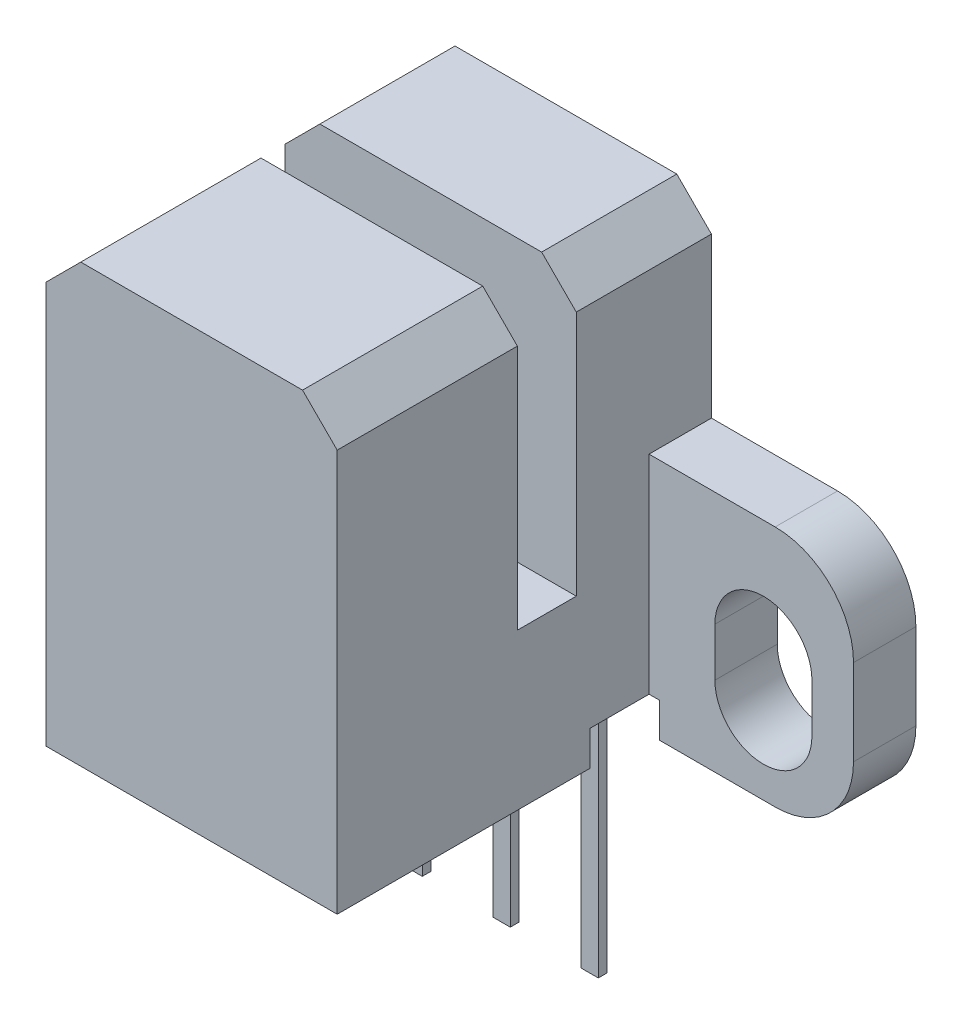
from build123d import *

# Parameters (mm, degrees)
SKETCH1_W           = 8.4
SKETCH1_H           = 12.6
BOSS_EXTRUDE1_DEPTH = 10.8
CHAMFER1_SIZE       = 1
BOSS_EXTRUDE2_DEPTH = 1.8
SKETCH3_W           = 8.4
SKETCH3_H           = 1.7
CUT_EXTRUDE1_DEPTH  = 8.1
SKETCH4_R           = 1
BOSS_EXTRUDE3_DEPTH = 0.8
SKETCH5_W           = 9
SKETCH5_H           = 3.5
CUT_EXTRUDE2_DEPTH  = 1
SKETCH6_W           = 0.5
SKETCH6_H           = 6.5
BOSS_EXTRUDE4_DEPTH = 0.125


with BuildPart() as part:
    # Sketch1 → Boss-Extrude1 (new body)
    with BuildSketch(Plane.XY):
        with Locations((0, -2.4)):
            Rectangle(SKETCH1_W, SKETCH1_H)
    extrude(amount=BOSS_EXTRUDE1_DEPTH)

    # Chamfer1
    chamfer1_edges = [part.edges().sort_by_distance(p)[0] for p in [
        (-4.2, 3.9, 5.4),
        (4.2, 3.9, 5.4),
    ]]
    chamfer(chamfer1_edges, length=CHAMFER1_SIZE)

    # Sketch2 → Boss-Extrude2 (add)
    with BuildSketch(Plane(origin=(0, 0, 0), x_dir=(-1, 0, 0), z_dir=(0, 0, -1))):
        with BuildLine():
            Line((-7.84, -8.7), (7.84, -8.7))
            ThreePointArc((7.84, -8.7), (9.438061325, -8.038061325), (10.1, -6.44))
            Line((10.1, -6.44), (10.1, -3.96))
            ThreePointArc((10.1, -3.96), (9.438061325, -2.361938675), (7.84, -1.7))
            Line((7.84, -1.7), (-7.84, -1.7))
            ThreePointArc((-7.84, -1.7), (-9.438061325, -2.361938675), (-10.1, -3.96))
            Line((-10.1, -3.96), (-10.1, -6.44))
            ThreePointArc((-10.1, -6.44), (-9.438061325, -8.038061325), (-7.84, -8.7))
        make_face()
        with BuildLine():
            Line((-6.1, -5), (-6.1, -6.4))
            ThreePointArc((-6.1, -6.4), (-7.5, -7.8), (-8.9, -6.4))
            Line((-8.9, -6.4), (-8.9, -5))
            ThreePointArc((-8.9, -5), (-7.5, -3.6), (-6.1, -5))
        make_face(mode=Mode.SUBTRACT)
        with BuildLine():
            Line((8.9, -5), (8.9, -6.4))
            ThreePointArc((8.9, -6.4), (7.5, -7.8), (6.1, -6.4))
            Line((6.1, -6.4), (6.1, -5))
            ThreePointArc((6.1, -5), (7.5, -3.6), (8.9, -5))
        make_face(mode=Mode.SUBTRACT)
    extrude(amount=-BOSS_EXTRUDE2_DEPTH)

    # Sketch3 → Cut-Extrude1 (cut)
    with BuildSketch(Plane(origin=(0, 3.9, 0), x_dir=(1, 0, 0), z_dir=(0, 1, 0))):
        with Locations((0, -4.75)):
            Rectangle(SKETCH3_W, SKETCH3_H)
    extrude(amount=-CUT_EXTRUDE1_DEPTH, mode=Mode.SUBTRACT)

    # Sketch4 → Boss-Extrude3 (add)
    with BuildSketch(Plane(origin=(0, 0, 0), x_dir=(-1, 0, 0), z_dir=(0, 0, -1))):
        Circle(SKETCH4_R)
        with Locations((0, -6.4)):
            Circle(SKETCH4_R)
    extrude(amount=BOSS_EXTRUDE3_DEPTH)

    # Sketch5 → Cut-Extrude2 (cut)
    with BuildSketch(Plane.XZ.offset(8.7)):
        with Locations((0, 1.75)):
            Rectangle(SKETCH5_W, SKETCH5_H)
    extrude(amount=-CUT_EXTRUDE2_DEPTH, mode=Mode.SUBTRACT)

    # Sketch6 → Boss-Extrude4 (add, symmetric)
    with BuildSketch(Plane(origin=(0, 0, 3), x_dir=(-1, 0, 0), z_dir=(0, 0, -1))):
        with Locations((-3.81, -10.95)):
            Rectangle(SKETCH6_W, SKETCH6_H)
        with Locations((-1.27, -10.95)):
            Rectangle(SKETCH6_W, SKETCH6_H)
        with Locations((1.27, -10.95)):
            Rectangle(SKETCH6_W, SKETCH6_H)
        with Locations((3.81, -10.95)):
            Rectangle(SKETCH6_W, SKETCH6_H)
    extrude(amount=BOSS_EXTRUDE4_DEPTH, both=True)


solid = part.part
